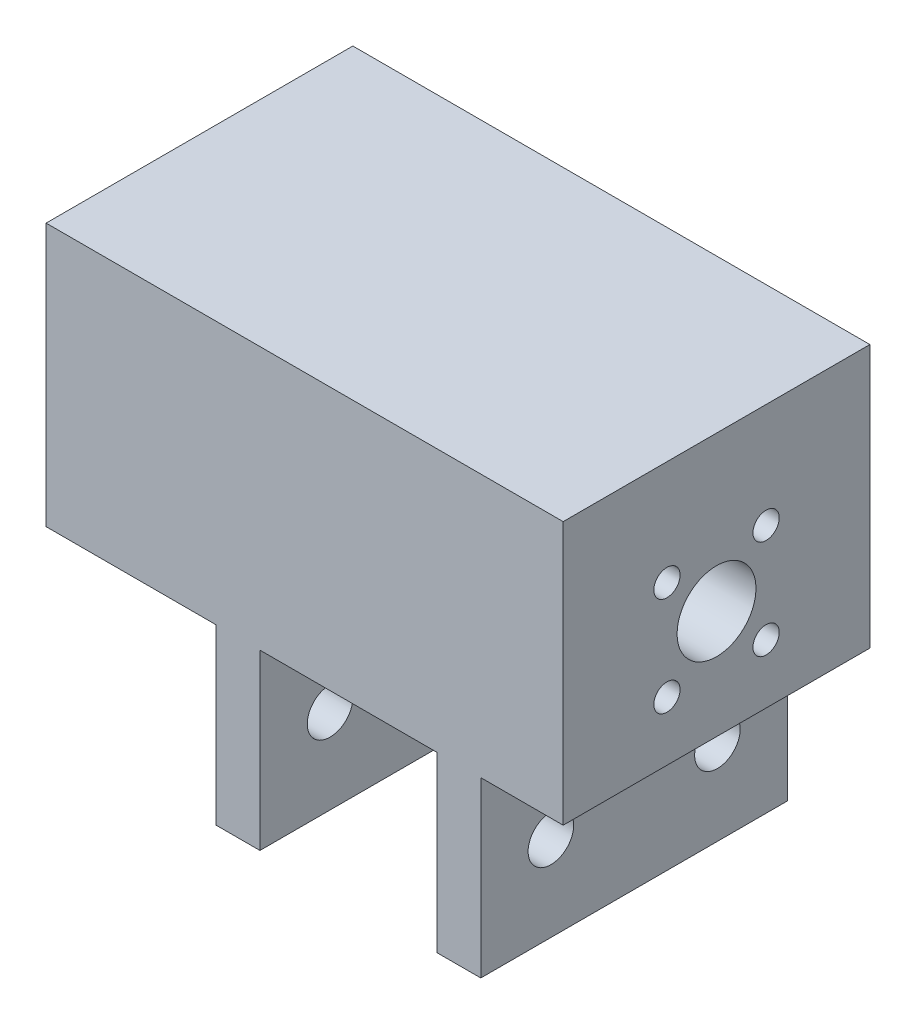
from build123d import *

# Parameters (mm, degrees)
EXTRUDE_1_DEPTH     = 35
HOLE_WIZARD_1_D     = 9
SKETCH_12_R         = 1.5
CUT_EXTRUDE_1_DEPTH = 70.548831766
SKETCH_15_R         = 5.2
CUT_EXTRUDE_4_DEPTH = 16
SKETCH_14_R         = 11.75
CUT_EXTRUDE_3_DEPTH = 4
HOLE_WIZARD_2_D     = 5.2
HOLE_WIZARD_2_DEPTH = 100
EXTRUDE_START       = 10
SKETCH_18_W         = 35
SKETCH_18_H         = 30
SKETCH_18_R         = 11.75
EXTRUDE_2_DEPTH     = 10


with BuildPart() as part:
    # 草图1 → 凸台-拉伸1 (new body)
    with BuildSketch(Plane.XY):
        Polygon((15.1, -15), (15.1, -34.8), (10.1, -34.8), (10.1, -15), (-10.1, -15), (-10.1, -34.8), (-15.1, -34.8), (-15.1, -15), (-24.5, -15), (-24.5, 15), (24.5, 15), (24.5, -15), align=None)
    extrude(amount=EXTRUDE_1_DEPTH)

    # 孔1 (through all)
    with Locations(Plane.ZY.offset(24.5)):
        with Locations((17.5, -2.6)):
            Hole(HOLE_WIZARD_1_D / 2)

    # 草图12 → 切除-拉伸1 (cut, through all)
    with BuildSketch(Plane.ZY.offset(24.5)):
        with Locations((11.843145751, 3.056854249)):
            Circle(SKETCH_12_R)
        with Locations((23.156854249, 3.056854249)):
            Circle(SKETCH_12_R)
        with Locations((23.156854249, -8.256854249)):
            Circle(SKETCH_12_R)
        with Locations((11.843145751, -8.256854249)):
            Circle(SKETCH_12_R)
    extrude(amount=-CUT_EXTRUDE_1_DEPTH, mode=Mode.SUBTRACT)

    # 草图15 → 切除-拉伸4 (cut)
    with BuildSketch(Plane.ZY.offset(24.5)):
        with Locations((17.5, -2.6)):
            Circle(SKETCH_15_R)
    extrude(amount=-CUT_EXTRUDE_4_DEPTH, mode=Mode.SUBTRACT)

    # 草图14 → 切除-拉伸3 (cut)
    with BuildSketch(Plane.ZY.offset(24.5)):
        with Locations((17.5, -2.6)):
            Circle(SKETCH_14_R)
    extrude(amount=-CUT_EXTRUDE_3_DEPTH, mode=Mode.SUBTRACT)

    # 孔2
    with Locations(Plane.ZY.offset(15.1)):
        with Locations((8, -25), (27, -25)):
            Hole(HOLE_WIZARD_2_D / 2, depth=HOLE_WIZARD_2_DEPTH)

    # 草图18 → 凸台-拉伸2 (add)
    with BuildSketch(Plane.ZY.offset(24.5).offset(EXTRUDE_START)):
        with Locations((17.5, 0)):
            Rectangle(SKETCH_18_W, SKETCH_18_H)
        with Locations((17.5, -2.6)):
            Circle(SKETCH_18_R, mode=Mode.SUBTRACT)
    extrude(amount=-EXTRUDE_2_DEPTH)


solid = part.part
